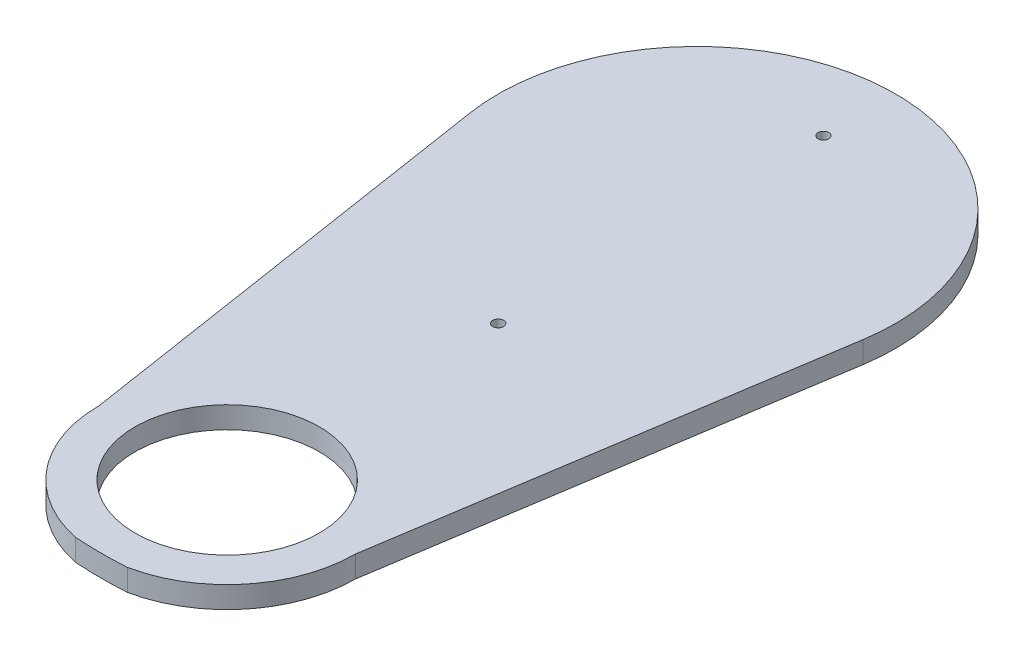
from build123d import *

# Parameters (mm, degrees)
SKETCH1_R           = 1.5
BOSS_EXTRUDE1_DEPTH = 6
CUT_EXTRUDE1_START  = -10
CUT_EXTRUDE1_DEPTH  = 10


with BuildPart() as part:
    # Sketch1 → Boss-Extrude1 (new body)
    # profile 1 of 3: a face of its own
    with BuildSketch(Plane(origin=(0, 0, 0), x_dir=(1, 0, 0), z_dir=(0, 1, 0))):
        with BuildLine():
            ThreePointArc((110, 0), (97.61406367, 50.709906072), (63.245553203, 90))
            Line((63.245553203, 90), (1.5, 90))
            ThreePointArc((1.5, 90), (0, 88.5), (-1.5, 90))
            Line((-1.5, 90), (-63.245553203, 90))
            ThreePointArc((-63.245553203, 90), (-109.405676864, 11.419188675), (-80.467384697, -75))
            Line((-80.467384697, -75), (-25.5, -75))
            ThreePointArc((-25.5, -75), (0, -49.5), (25.5, -75))
            Line((25.5, -75), (80.467384697, -75))
            ThreePointArc((80.467384697, -75), (102.350897203, -40.302528973), (110, 0))
        make_face()
        with Locations(Location((0, 0, 0), (0, 0, 270))):
            Circle(SKETCH1_R, mode=Mode.SUBTRACT)
    # profile 2 of 3: a face of its own
    with BuildSketch(Plane(origin=(0, 0, 0), x_dir=(1, 0, 0), z_dir=(0, 1, 0))):
        with BuildLine():
            ThreePointArc((-80.467384697, -75), (0, -110), (80.467384697, -75))
            Line((80.467384697, -75), (25.5, -75))
            ThreePointArc((25.5, -75), (0, -100.5), (-25.5, -75))
            Line((-25.5, -75), (-80.467384697, -75))
        make_face()
    # profile 3 of 3: a face of its own
    with BuildSketch(Plane(origin=(0, 0, 0), x_dir=(1, 0, 0), z_dir=(0, 1, 0))):
        with BuildLine():
            Line((1.5, 90), (63.245553203, 90))
            ThreePointArc((63.245553203, 90), (0, 110), (-63.245553203, 90))
            Line((-63.245553203, 90), (-1.5, 90))
            ThreePointArc((-1.5, 90), (0, 91.5), (1.5, 90))
        make_face()
    extrude(amount=BOSS_EXTRUDE1_DEPTH)

    # Sketch2 → Cut-Extrude1 (cut)
    with BuildSketch(Plane(origin=(0, 6, 0), x_dir=(1, 0, 0), z_dir=(0, 1, 0)).offset(CUT_EXTRUDE1_START)):
        with BuildLine():
            Line((54.350525887, 46.572643608), (35.5, -75))
            ThreePointArc((35.5, -75), (27.52606276, -97.417980929), (7.18642992, -109.765))
            ThreePointArc((7.18642992, -109.765), (80.282337071, -75.198047544), (110, 0))
            ThreePointArc((110, 0), (77.781745816, 77.781746045), (-3.23e-07, 110))
            ThreePointArc((-3.23e-07, 110), (38.890872851, 93.890873079), (55, 55))
            ThreePointArc((55, 55), (54.837391093, 50.773827015), (54.350525887, 46.572643608))
        make_face()
        with BuildLine():
            ThreePointArc((-7.18642992, -109.765), (-27.52606276, -97.417980929), (-35.5, -75))
            Line((-35.5, -75), (-54.350525887, 46.572643608))
            ThreePointArc((-54.350525887, 46.572643608), (-41.764246786, 90.787535406), (-3.23e-07, 110))
            ThreePointArc((-3.23e-07, 110), (-109.941234308, 3.595135441), (-7.18642992, -109.765))
        make_face()
    extrude(amount=CUT_EXTRUDE1_DEPTH, mode=Mode.SUBTRACT)


solid = part.part
